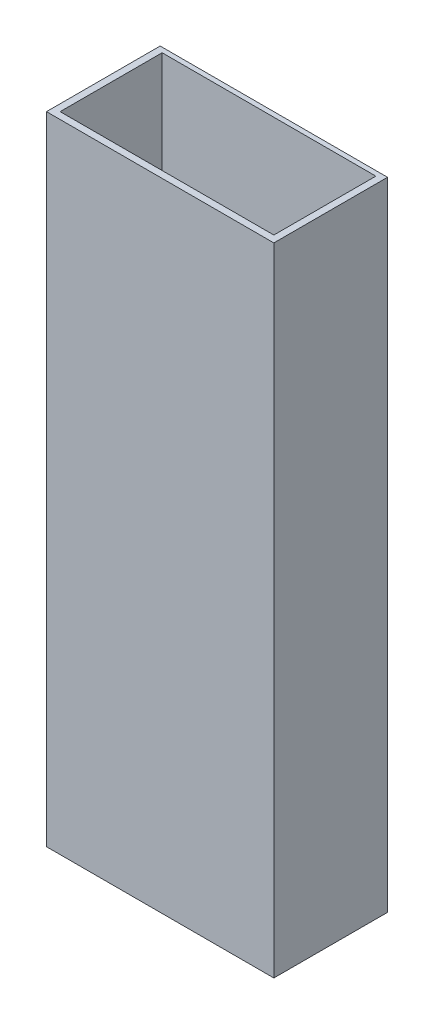
from build123d import *

# Parameters (mm, degrees)
SKETCH1_W           = 50
SKETCH1_H           = 25
SKETCH1_W_2         = 47
SKETCH1_H_2         = 22.434387025
BOSS_EXTRUDE1_DEPTH = 140


with BuildPart() as part:
    # Sketch1 → Boss-Extrude1 (new body)
    with BuildSketch(Plane(origin=(0, 0, 0), x_dir=(1, 0, 0), z_dir=(0, 1, 0))):
        with Locations((25, 12.5)):
            Rectangle(SKETCH1_W, SKETCH1_H)
        with Locations((25, 12.717193513)):
            Rectangle(SKETCH1_W_2, SKETCH1_H_2, mode=Mode.SUBTRACT)
    extrude(amount=BOSS_EXTRUDE1_DEPTH)


solid = part.part
